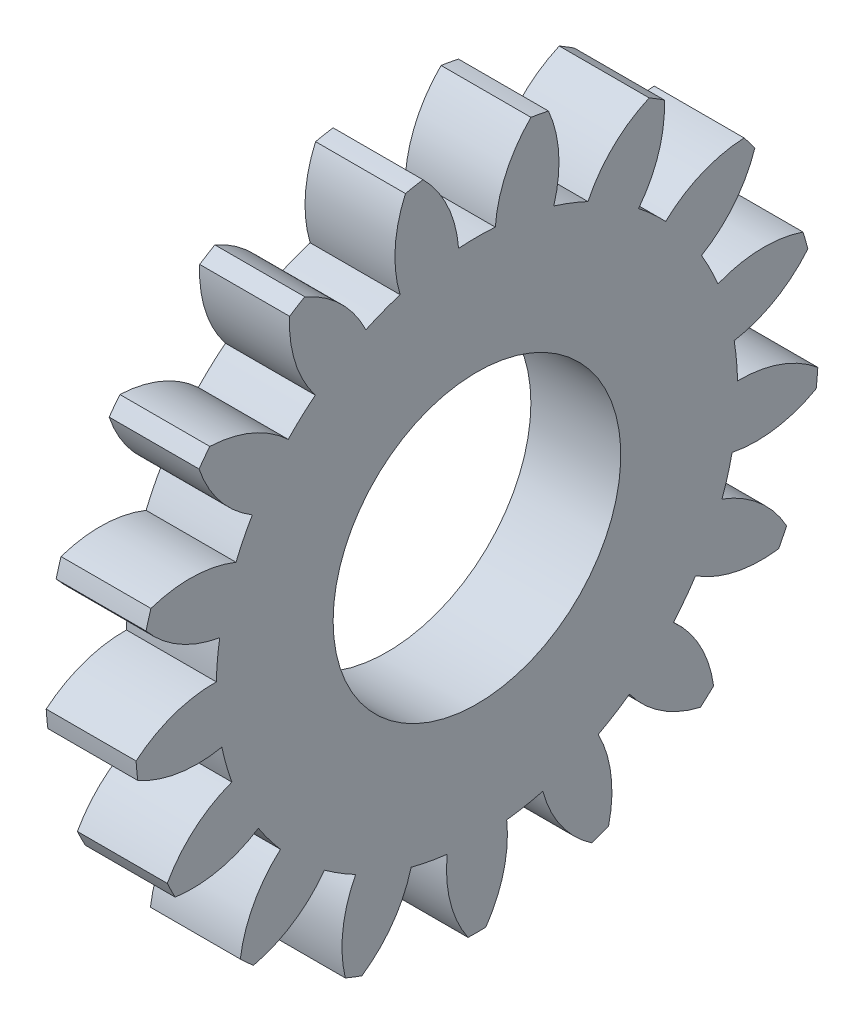
from build123d import *

# Parameters (mm, degrees)
BASPROSKE_W     = 5
BASPROSKE_H     = 19
TOOTHCUT_DEPTH  = 28.331300737
TEETHCUTS_COUNT = 17
TEETHCUTS_ANGLE = 338.823529412
BORSKE_R        = 8
BORE_DEPTH      = 50.0000508


with BuildPart() as part:
    # BasProSke → Base-Revolve (revolve)
    with BuildSketch(Plane(origin=(0, 0, 0), x_dir=(1, 0, 0), z_dir=(0, 1, 0)), mode=Mode.PRIVATE) as base_revolve_sk:
        with Locations((2.5, 9.5)):
            Rectangle(BASPROSKE_W, BASPROSKE_H)
    revolve(base_revolve_sk.sketch.rotate(Axis((-10, 0, 0), (1, 0, 0)), 180), axis=Axis((-10, 0, 0), (1, 0, 0)))

    # TooCutSke → ToothCut (cut, through all)
    with BuildSketch(Plane(origin=(0, 0, 0), x_dir=(0, 0, -1), z_dir=(1, 0, 0))):
        with BuildLine():
            ThreePointArc((1.020352389, 14.463052306), (0, 14.499), (-1.020352389, 14.463052306))
            ThreePointArc((-1.020352389, 14.463052306), (-1.632621885, 16.804485203), (-3.026143023, 18.783192049))
            ThreePointArc((-3.026143023, 18.783192049), (0, 19.0254), (3.026143023, 18.783192049))
            ThreePointArc((3.026143023, 18.783192049), (1.632621885, 16.804485203), (1.020352389, 14.463052306))
        make_face()
    toothcut = extrude(amount=TOOTHCUT_DEPTH, mode=Mode.SUBTRACT)

    # TeethCuts: ToothCut ×17 about axis
    teethcuts_axis = Axis((-10, 0, 0), (1, 0, 0))
    for i in range(1, TEETHCUTS_COUNT):
        add(toothcut.rotate(teethcuts_axis, i * TEETHCUTS_ANGLE / (TEETHCUTS_COUNT - 1)), mode=Mode.SUBTRACT)

    # BorSke → Bore (cut, symmetric)
    with BuildSketch(Plane(origin=(0, 0, 0), x_dir=(0, 0, -1), z_dir=(1, 0, 0))):
        with Locations(Location((0, 0, 0), (0, 0, 180))):
            Circle(BORSKE_R)
    extrude(amount=BORE_DEPTH, both=True, mode=Mode.SUBTRACT)


solid = part.part
